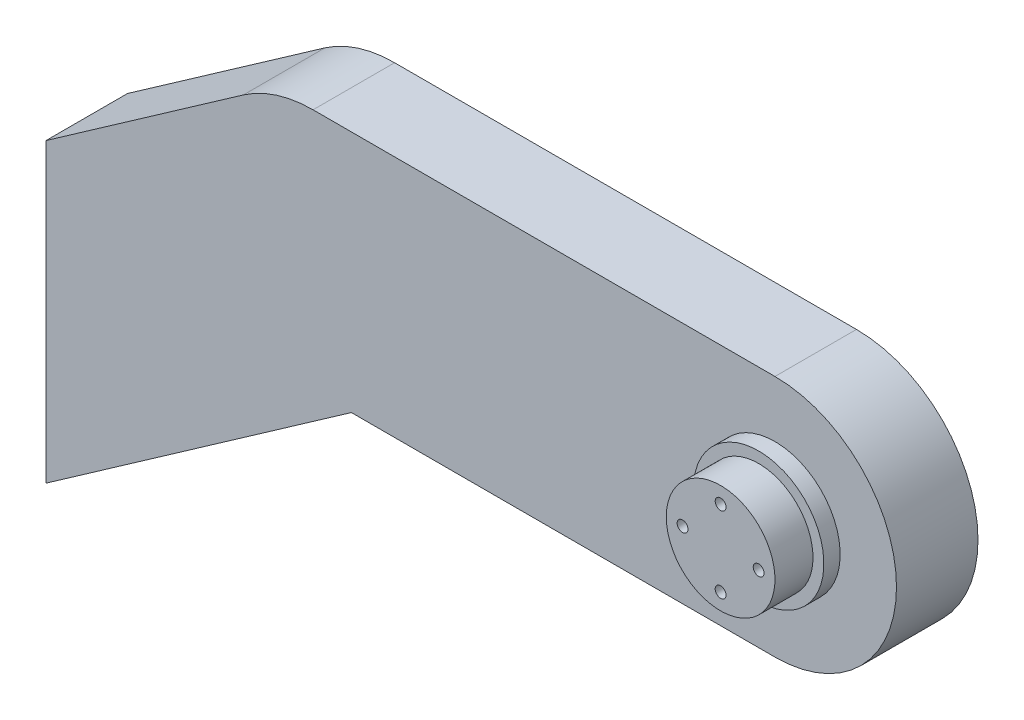
from build123d import *

# Parameters (mm, degrees)
SKETCH_1_W          = 300
SKETCH_1_H          = 44.73
EXTRUDE_1_DEPTH     = 15
CUT_EXTRUDE_4_REACH = 305.687
EXTRUDE_START       = -15
SKETCH_6_R          = 10
EXTRUDE_2_DEPTH     = 10
SKETCH_7_R          = 1
CUT_EXTRUDE_6_DEPTH = 5
EXTRUDE_5_DEPTH     = 15
CUT_EXTRUDE_7_DEPTH = 15
SKETCH_11_R         = 12
SKETCH_11_R_2       = 10
EXTRUDE_6_DEPTH     = 3


with BuildPart() as part:
    # 草图1 → 凸台-拉伸1 (new body)
    with BuildSketch(Plane.XY):
        with Locations((150, 22.365)):
            Rectangle(SKETCH_1_W, SKETCH_1_H)
    extrude(amount=EXTRUDE_1_DEPTH)

    # 草图4 → 切除-拉伸4 (cut, up to next)
    with BuildSketch(Plane.XY.offset(15), mode=Mode.PRIVATE) as cut_extrude_4_sk1:
        with BuildLine():
            Line((300, 44.73), (153.211623388, 44.73))
            ThreePointArc((153.211623388, 44.73), (175.576623388, 22.365), (153.211623388, 0))
            Line((153.211623388, 0), (300, 0))
            Line((300, 0), (300, 44.73))
        make_face()
    cut_extrude_4_tool1 = extrude(cut_extrude_4_sk1.sketch, amount=-CUT_EXTRUDE_4_REACH, mode=Mode.PRIVATE) & part.part
    add(cut_extrude_4_tool1.solids().sort_by_distance((235.292113, 22.365, 15))[0], mode=Mode.SUBTRACT)

    # 草图6 → 凸台-拉伸2 (add)
    with BuildSketch(Plane(origin=(0, 0, 0), x_dir=(-1, 0, 0), z_dir=(0, 0, -1)).offset(EXTRUDE_START)):
        with Locations((-153.211623388, 22.365)):
            Circle(SKETCH_6_R)
    extrude(amount=-EXTRUDE_2_DEPTH)

    # 草图7 → 切除-拉伸6 (cut)
    with BuildSketch(Plane.XY.offset(25)):
        with Locations((153.211623388, 29.365)):
            Circle(SKETCH_7_R)
        with Locations((160.211623388, -284.058246776)):
            Circle(SKETCH_7_R)
        with Locations((-153.211623388, -291.058246776)):
            Circle(SKETCH_7_R)
        with Locations((-160.211623388, 22.365)):
            Circle(SKETCH_7_R)
        with Locations((160.211623388, 22.365)):
            Circle(SKETCH_7_R)
        with Locations((153.211623388, 15.365)):
            Circle(SKETCH_7_R)
        with Locations((146.211623388, 22.365)):
            Circle(SKETCH_7_R)
    extrude(amount=-CUT_EXTRUDE_6_DEPTH, mode=Mode.SUBTRACT)

    # 草图9 → 凸台-拉伸5 (add)
    with BuildSketch(Plane.XY):
        Polygon((19.062500731, -39.352209859), (75.263280801, 0), (19.062500731, 0), align=None)
    extrude(amount=EXTRUDE_5_DEPTH)

    # 草图10 → 切除-拉伸7 (cut)
    with BuildSketch(Plane(origin=(0, 0, 0), x_dir=(-1, 0, 0), z_dir=(0, 0, -1))):
        with BuildLine():
            Line((-19.062500731, 15.253037497), (-19.062500731, 0))
            Line((-19.062500731, 0), (0, 0))
            Line((0, 0), (0, 44.73))
            Line((0, 44.73), (-68.211623388, 44.73))
            ThreePointArc((-68.211623388, 44.73), (-61.486338182, 43.694879603), (-55.383586389, 40.685335471))
            Line((-55.383586389, 40.685335471), (-19.062500731, 15.253037497))
        make_face()
    extrude(amount=-CUT_EXTRUDE_7_DEPTH, mode=Mode.SUBTRACT)

    # 草图11 → 凸台-拉伸6 (add)
    with BuildSketch(Plane(origin=(0, 0, 0), x_dir=(-1, 0, 0), z_dir=(0, 0, -1)).offset(EXTRUDE_START)):
        with Locations((-153.211623388, 22.365)):
            Circle(SKETCH_11_R)
        with Locations((-153.211623388, 22.365)):
            Circle(SKETCH_11_R_2, mode=Mode.SUBTRACT)
    extrude(amount=-EXTRUDE_6_DEPTH)


solid = part.part
